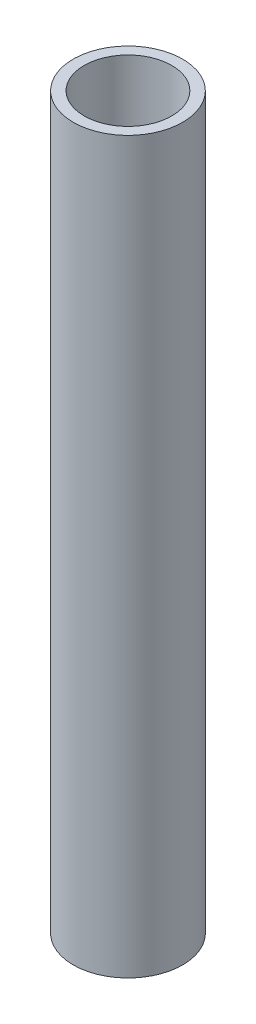
from build123d import *

# Parameters (mm, degrees)
SKETCH1_R                   = 15
EXTRUDE1_DEPTH              = 200
SKETCH2_R                   = 12
CUT_EXTRUDE1_DEPTH          = 190
M6_TAPPED_HOLE2_D           = 5
M6_TAPPED_HOLE2_DEPTH       = 15
M6_TAPPED_HOLE2_CBORE_D     = 6
M6_TAPPED_HOLE2_CBORE_DEPTH = 12
M6_TAPPED_HOLE2_TIP         = 1.502151548


with BuildPart() as part:
    # Sketch1 → Extrude1 (new body)
    with BuildSketch(Plane(origin=(0, 0, 0), x_dir=(1, 0, 0), z_dir=(0, 1, 0))):
        with Locations(Location((0, 0, 0), (0, 0, 270))):
            Circle(SKETCH1_R)
    extrude(amount=-EXTRUDE1_DEPTH)

    # Sketch2 → Cut-Extrude1 (cut)
    with BuildSketch(Plane(origin=(0, 0, 0), x_dir=(1, 0, 0), z_dir=(0, 1, 0))):
        with Locations(Location((0, 0, 0), (0, 0, 270))):
            Circle(SKETCH2_R)
    extrude(amount=-CUT_EXTRUDE1_DEPTH, mode=Mode.SUBTRACT)

    # M6 Tapped Hole2
    with Locations(Plane.XZ.offset(200)):
        with Locations((0, 0)):
            CounterBoreHole(M6_TAPPED_HOLE2_D / 2, M6_TAPPED_HOLE2_CBORE_D / 2, M6_TAPPED_HOLE2_CBORE_DEPTH, depth=M6_TAPPED_HOLE2_DEPTH)
            with Locations((0, 0, -(M6_TAPPED_HOLE2_DEPTH + M6_TAPPED_HOLE2_TIP / 2))):  # 118° drill point
                Cone(0, M6_TAPPED_HOLE2_D / 2, M6_TAPPED_HOLE2_TIP, mode=Mode.SUBTRACT)


solid = part.part
